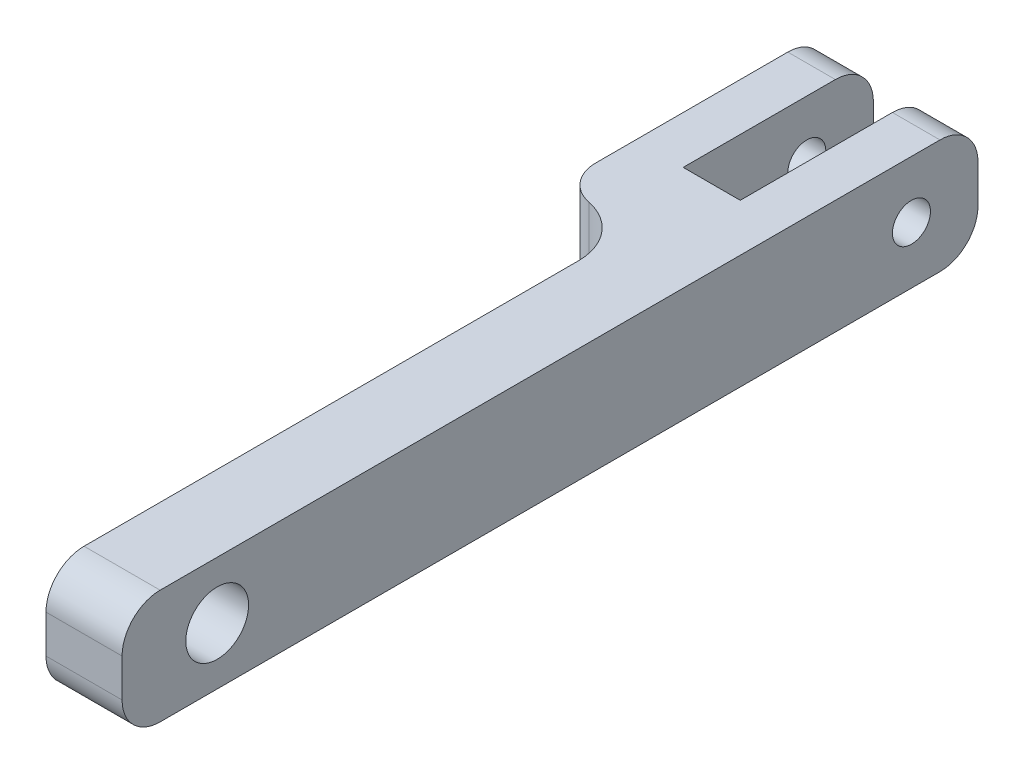
from build123d import *

# Parameters (mm, degrees)
SKETCH1_W           = 45
SKETCH1_H           = 6
BOSS_EXTRUDE1_DEPTH = 4
SKETCH2_R           = 1.65
CUT_EXTRUDE1_DEPTH  = 46.57411546
SKETCH4_W           = 14
SKETCH4_H           = 6
BOSS_EXTRUDE2_DEPTH = 4
SKETCH5_W           = 3
SKETCH5_H           = 6
CUT_EXTRUDE2_DEPTH  = 10
SKETCH6_R           = 1
CUT_EXTRUDE3_DEPTH  = 47.097722286
FILLET1_R           = 2
FILLET2_R           = 3
FILLET3_R           = 2
FILLET4_R           = 2


with BuildPart() as part:
    # Sketch1 → Boss-Extrude1 (new body)
    with BuildSketch(Plane(origin=(0, 0, 0), x_dir=(0, 0, -1), z_dir=(1, 0, 0))):
        with Locations((22.5, -3)):
            Rectangle(SKETCH1_W, SKETCH1_H)
    extrude(amount=BOSS_EXTRUDE1_DEPTH)

    # Sketch2 → Cut-Extrude1 (cut, through all)
    with BuildSketch(Plane(origin=(4, 0, 0), x_dir=(0, 0, -1), z_dir=(1, 0, 0))):
        with Locations((5, -3)):
            Circle(SKETCH2_R)
    extrude(amount=-CUT_EXTRUDE1_DEPTH, mode=Mode.SUBTRACT)

    # Sketch4 → Boss-Extrude2 (add)
    with BuildSketch(Plane.ZY):
        with Locations((-38, -3)):
            Rectangle(SKETCH4_W, SKETCH4_H)
    extrude(amount=BOSS_EXTRUDE2_DEPTH)

    # Sketch5 → Cut-Extrude2 (cut)
    with BuildSketch(Plane(origin=(0, 0, -45), x_dir=(-1, 0, 0), z_dir=(0, 0, -1))):
        with Locations((0, -3)):
            Rectangle(SKETCH5_W, SKETCH5_H)
    extrude(amount=-CUT_EXTRUDE2_DEPTH, mode=Mode.SUBTRACT)

    # Sketch6 → Cut-Extrude3 (cut, through all)
    with BuildSketch(Plane.ZY.offset(4)):
        with Locations((-41.5, -3)):
            Circle(SKETCH6_R)
    extrude(amount=-CUT_EXTRUDE3_DEPTH, mode=Mode.SUBTRACT)

    # Fillet1
    fillet1_edges = [part.edges().sort_by_distance(p)[0] for p in [
        (2, 0, 0),
        (2.75, 0, -45),
        (2.75, -6, -45),
        (2, -6, 0),
    ]]
    fillet(fillet1_edges, radius=FILLET1_R)

    # Fillet2
    fillet2_edges = [part.edges().sort_by_distance(p)[0] for p in [
        (0, -3, -31),
    ]]
    fillet(fillet2_edges, radius=FILLET2_R)

    # Fillet3
    fillet3_edges = [part.edges().sort_by_distance(p)[0] for p in [
        (-4, -3, -31),
    ]]
    fillet(fillet3_edges, radius=FILLET3_R)

    # Fillet4
    fillet4_edges = [part.edges().sort_by_distance(p)[0] for p in [
        (-2.75, 0, -45),
        (-2.75, -6, -45),
    ]]
    fillet(fillet4_edges, radius=FILLET4_R)


solid = part.part
